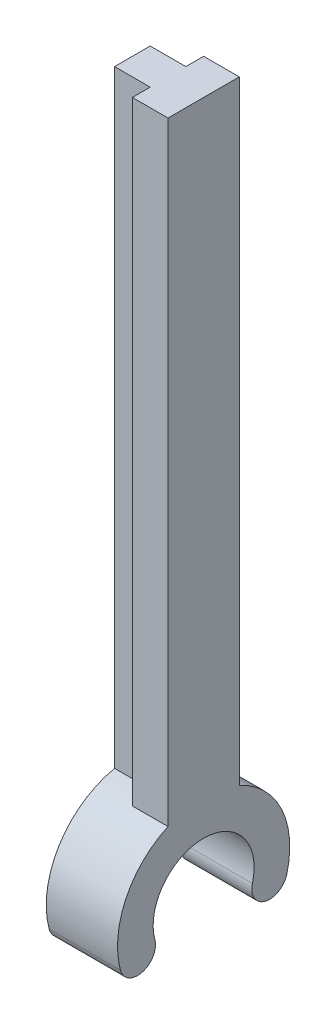
from build123d import *

# Parameters (mm, degrees)
BOSS_EXTRUDE1_DEPTH      = 3
BOSS_EXTRUDE1_DEPTH_BACK = 3
BOSS_EXTRUDE2_DEPTH      = 3
BOSS_EXTRUDE3_DEPTH      = 3


with BuildPart() as part:
    # Sketch1 → Boss-Extrude1 (new, two sides: drawn at the far end of the back side and taken through both)
    with BuildSketch(Plane(origin=(0, 0, 0), x_dir=(0, 0, -1), z_dir=(1, 0, 0)).offset(-BOSS_EXTRUDE1_DEPTH_BACK)):
        with BuildLine():
            ThreePointArc((-4.105184762, -1.099980942), (0, 4.25), (4.105184762, -1.099980942))
            ThreePointArc((4.105184762, -1.099980942), (5.165844934, -2.937098249), (7.002962241, -1.876438077))
            ThreePointArc((7.002962241, -1.876438077), (0, 7.25), (-7.002962241, -1.876438077))
            ThreePointArc((-7.002962241, -1.876438077), (-5.165844934, -2.937098249), (-4.105184762, -1.099980942))
        make_face()
    extrude(amount=BOSS_EXTRUDE1_DEPTH + BOSS_EXTRUDE1_DEPTH_BACK)

    # Sketch2 → Boss-Extrude2 (add)
    with BuildSketch(Plane(origin=(0, 0, 0), x_dir=(0, 0, -1), z_dir=(1, 0, 0))):
        Polygon((-3, 5.25), (0, 5.25), (3, 5.25), (3, 58.25), (-3, 58.25), align=None)
    extrude(amount=BOSS_EXTRUDE2_DEPTH)

    # Sketch3 → Boss-Extrude3 (add)
    with BuildSketch(Plane(origin=(0, 0, 0), x_dir=(0, 0, -1), z_dir=(1, 0, 0))):
        Polygon((1.5, 58.25), (0, 58.25), (-1.5, 58.25), (-1.5, 5.25), (1.5, 5.25), align=None)
    extrude(amount=-BOSS_EXTRUDE3_DEPTH)


solid = part.part
